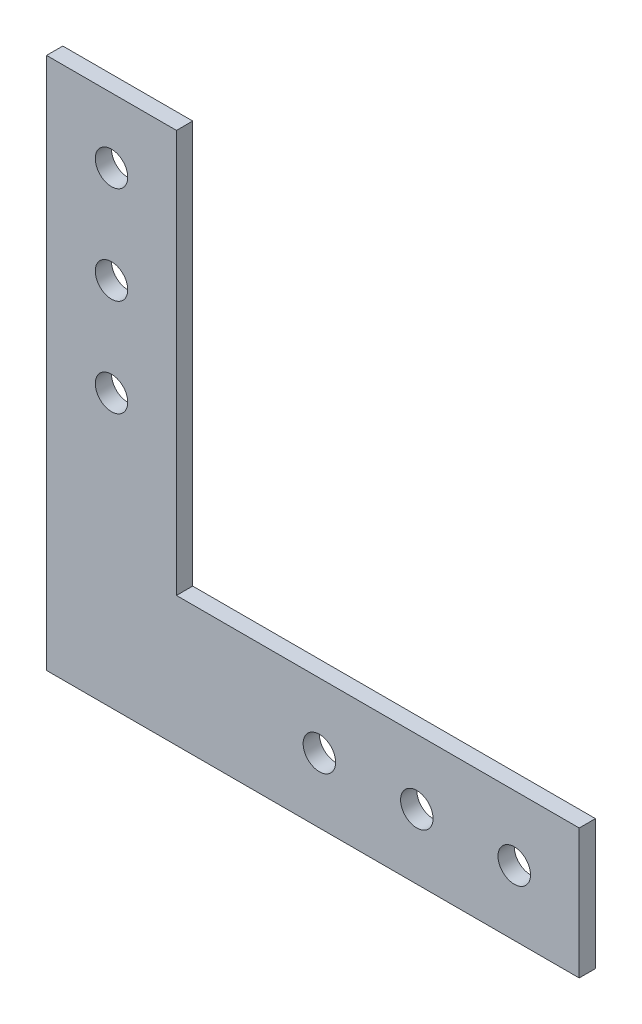
from build123d import *

# Parameters (mm, degrees)
BOSS_EXTRUDE1_DEPTH = 3.175
SKETCH2_R           = 3.175
CUT_EXTRUDE1_DEPTH  = 148.310419947


with BuildPart() as part:
    # Sketch1 → Boss-Extrude1 (new body)
    with BuildSketch(Plane.XY):
        Polygon((0, 25.4), (0, 0), (25.4, 0), (104.14, 0), (104.14, 25.4), (25.4, 25.4), (25.4, 104.14), (0, 104.14), align=None)
    extrude(amount=BOSS_EXTRUDE1_DEPTH)

    # Sketch2 → Cut-Extrude1 (cut, through all)
    with BuildSketch(Plane.XY.offset(3.175)):
        with Locations((53.34, 12.7)):
            Circle(SKETCH2_R)
        with Locations((72.39, 12.7)):
            Circle(SKETCH2_R)
        with Locations((12.7, 53.34)):
            Circle(SKETCH2_R)
        with Locations((12.7, 72.39)):
            Circle(SKETCH2_R)
        with Locations((12.7, 91.44)):
            Circle(SKETCH2_R)
        with Locations((91.44, 12.7)):
            Circle(SKETCH2_R)
    extrude(amount=-CUT_EXTRUDE1_DEPTH, mode=Mode.SUBTRACT)


solid = part.part
